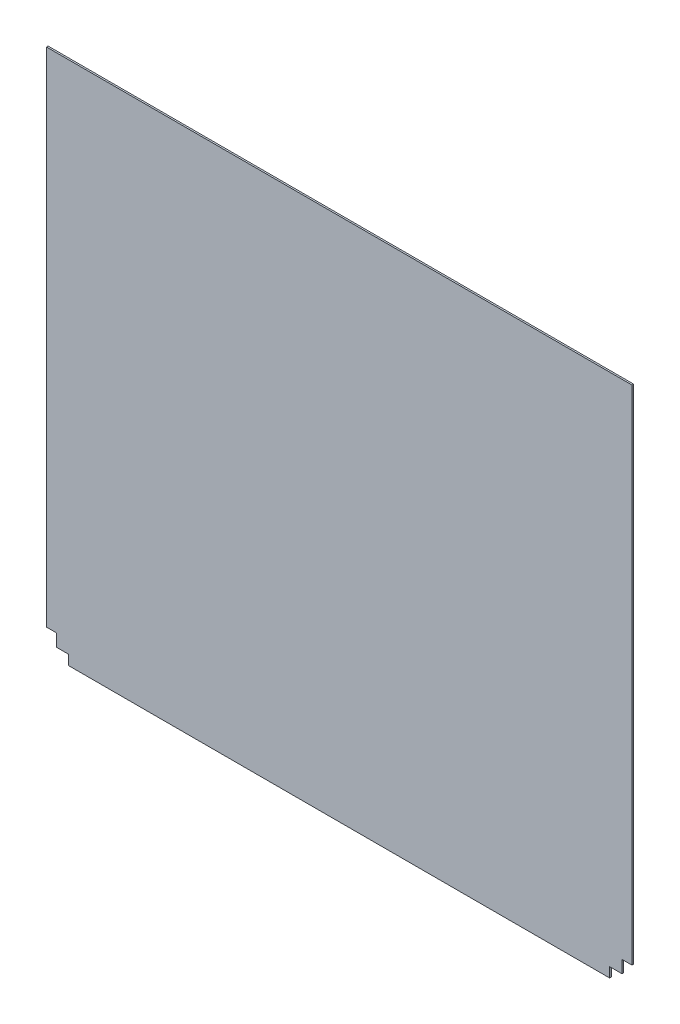
from build123d import *

# Parameters (mm, degrees)
BOSS_EXTRUDE1_DEPTH = 2.54


with BuildPart() as part:
    # Sketch1 → Boss-Extrude1 (new body)
    with BuildSketch(Plane.XY):
        Polygon((0, 812.8), (0, 34.544), (15.24, 34.544), (15.24, 15.24), (34.544, 15.24), (34.544, 0), (872.45698, 0), (872.45698, 15.24), (891.76098, 15.24), (891.76098, 34.544), (907.00098, 34.544), (907.00098, 812.8), align=None)
    extrude(amount=BOSS_EXTRUDE1_DEPTH)


solid = part.part
